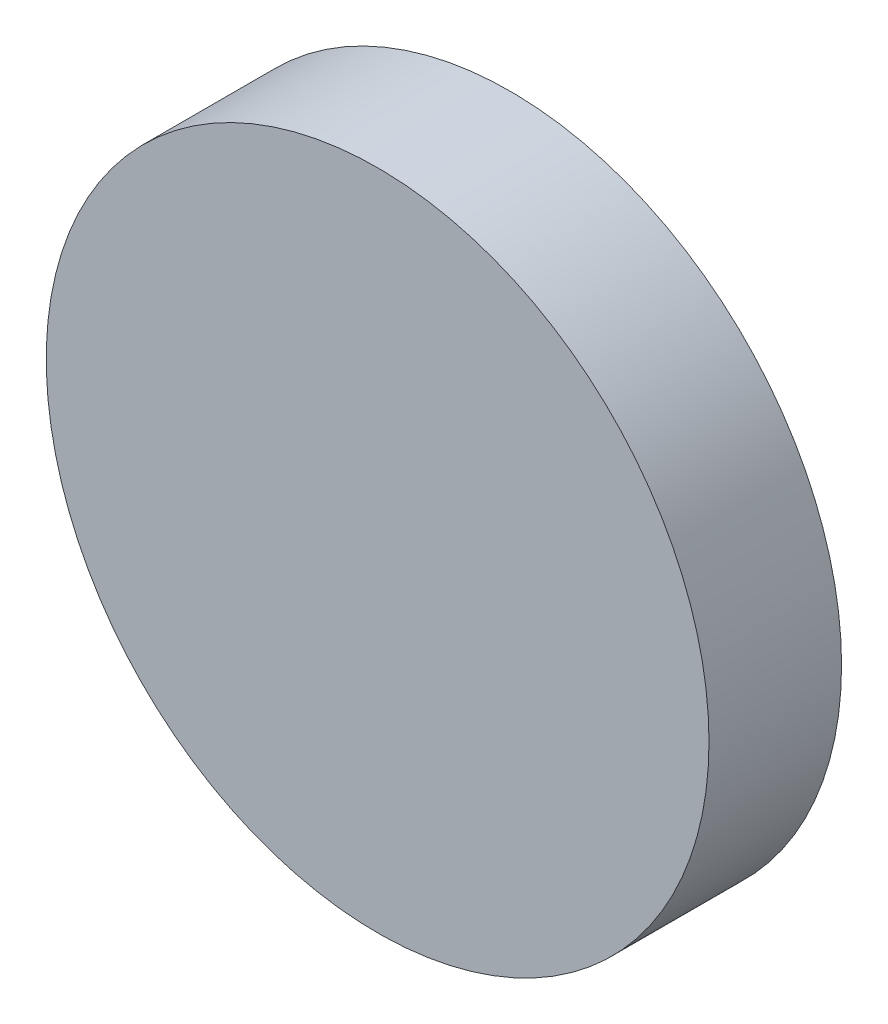
from build123d import *

# Parameters (mm, degrees)
SKETCH1_R           = 12.5
BOSS_EXTRUDE1_DEPTH = 5


with BuildPart() as part:
    # Sketch1 → Boss-Extrude1 (new body)
    with BuildSketch(Plane.XY):
        Circle(SKETCH1_R)
    extrude(amount=BOSS_EXTRUDE1_DEPTH)


solid = part.part
